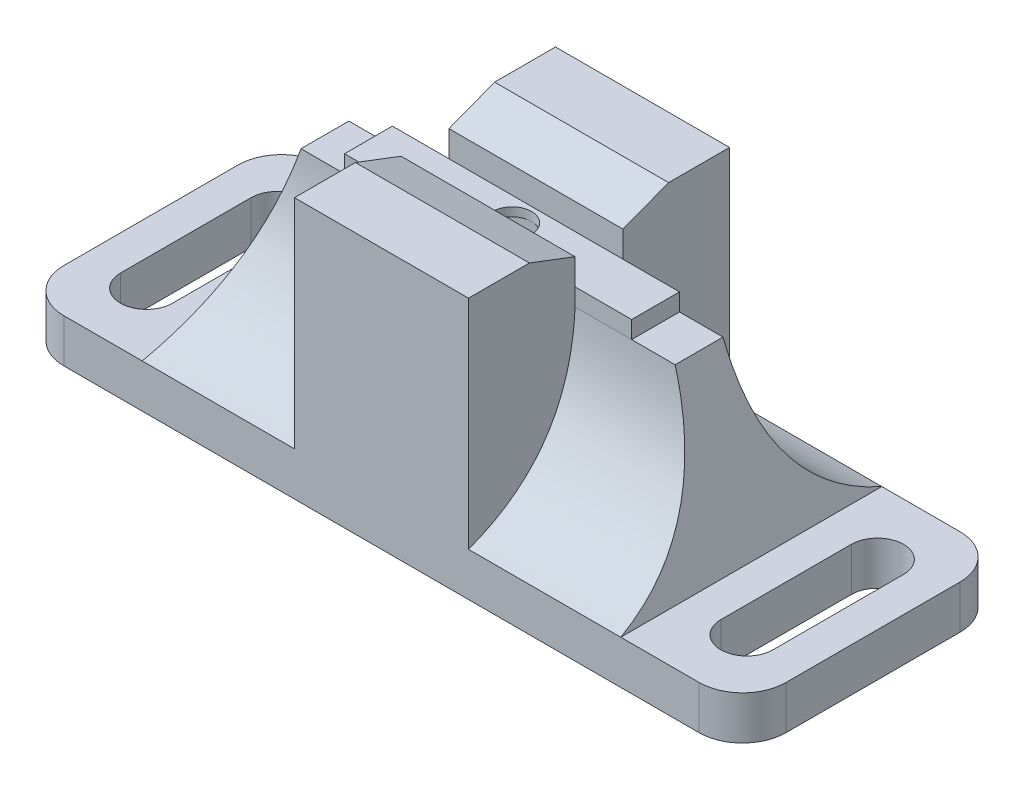
from build123d import *

# Parameters (mm, degrees)
BOSS_EXTRUDE1_DEPTH     = 5
BOSS_EXTRUDE2_DEPTH     = 27.5
BOSS_EXTRUDE3_DEPTH     = 10
CUT_EXTRUDE2_DEPTH      = 51.717354111
CUT_EXTRUDE2_DEPTH_BACK = 51.717354111
SKETCH5_3_W             = 6.5
SKETCH5_3_H             = 2
SKETCH5_3_W_2           = 20
BOSS_EXTRUDE4_DEPTH     = 2.75
CUT_EXTRUDE3_DEPTH      = 54.359629019
CUT_EXTRUDE3_DEPTH_BACK = 24
M4_CLEARANCE_HOLE1_D    = 4.5


with BuildPart() as part:
    # Sketch1 → Boss-Extrude1 (new body)
    with BuildSketch(Plane(origin=(0, 0, 0), x_dir=(1, 0, 0), z_dir=(0, 1, 0))):
        with BuildLine():
            Line((-36.5, 15), (36.5, 15))
            ThreePointArc((36.5, 15), (40.035533906, 13.535533906), (41.5, 10))
            Line((41.5, 10), (41.5, -10))
            ThreePointArc((41.5, -10), (40.035533906, -13.535533906), (36.5, -15))
            Line((36.5, -15), (-36.5, -15))
            ThreePointArc((-36.5, -15), (-40.035533906, -13.535533906), (-41.5, -10))
            Line((-41.5, -10), (-41.5, 10))
            ThreePointArc((-41.5, 10), (-40.035533906, 13.535533906), (-36.5, 15))
        make_face()
        with BuildLine():
            Line((-31.5, 7.5), (-31.5, -7.5))
            ThreePointArc((-31.5, -7.5), (-34.5, -10.5), (-37.5, -7.5))
            Line((-37.5, -7.5), (-37.5, 7.5))
            ThreePointArc((-37.5, 7.5), (-34.5, 10.5), (-31.5, 7.5))
        make_face(mode=Mode.SUBTRACT)
        with BuildLine():
            Line((31.5, 7.5), (31.5, -7.5))
            ThreePointArc((31.5, -7.5), (34.5, -10.5), (37.5, -7.5))
            Line((37.5, -7.5), (37.5, 7.5))
            ThreePointArc((37.5, 7.5), (34.5, 10.5), (31.5, 7.5))
        make_face(mode=Mode.SUBTRACT)
    extrude(amount=-BOSS_EXTRUDE1_DEPTH)

    # Sketch2 → Boss-Extrude2 (add, symmetric)
    with BuildSketch(Plane(origin=(0, 0, 0), x_dir=(0, 0, -1), z_dir=(1, 0, 0))):
        with BuildLine():
            Line((-15, 0), (0, 0))
            Line((0, 0), (0, 18))
            Line((0, 18), (-2.75, 18))
            add(Edge.make_bspline(
                [(-15, 0), (-3.342305564, 4.287493928), (-2.75, 18)],
                knots=[0, 0, 0, 1, 1, 1], degree=2))
        make_face()
        with BuildLine():
            Line((0, 18), (0, 0))
            Line((0, 0), (15, 0))
            add(Edge.make_bspline(
                [(15, 0), (3.342305564, 4.287493928), (2.75, 18)],
                knots=[0, 0, 0, 1, 1, 1], degree=2))
            Line((2.75, 18), (0, 18))
        make_face()
    extrude(amount=BOSS_EXTRUDE2_DEPTH, both=True)

    # Sketch2<3> → Boss-Extrude3 (add, symmetric)
    with BuildSketch(Plane(origin=(0, 0, 0), x_dir=(0, 0, -1), z_dir=(1, 0, 0))):
        with BuildLine():
            Line((-15, 0), (-15, 25))
            Line((-15, 25), (-8, 25))
            Line((-8, 25), (-2.75, 23))
            Line((-2.75, 23), (-2.75, 18))
            add(Edge.make_bspline(
                [(-15, 0), (-3.342305564, 4.287493928), (-2.75, 18)],
                knots=[0, 0, 0, 1, 1, 1], degree=2))
        make_face()
        with BuildLine():
            add(Edge.make_bspline(
                [(15, 0), (3.342305564, 4.287493928), (2.75, 18)],
                knots=[0, 0, 0, 1, 1, 1], degree=2))
            Line((2.75, 18), (2.75, 23))
            Line((2.75, 23), (8, 25))
            Line((8, 25), (15, 25))
            Line((15, 25), (15, 0))
        make_face()
    extrude(amount=BOSS_EXTRUDE3_DEPTH, both=True)

    # Sketch5 → Cut-Extrude2 (cut, two sides: drawn at the far end of the back side and taken through both)
    with BuildSketch(Plane.XY.offset(-CUT_EXTRUDE2_DEPTH_BACK)):
        Polygon((-27.5, 18), (-27.5, 0), (-21.5, 18), align=None)
        Polygon((21.5, 18), (27.5, 0), (27.5, 18), align=None)
    extrude(amount=CUT_EXTRUDE2_DEPTH + CUT_EXTRUDE2_DEPTH_BACK, mode=Mode.SUBTRACT)

    # Sketch5<3> → Boss-Extrude4 (add, symmetric)
    with BuildSketch(Plane.XY):
        with Locations((13.25, 19)):
            Rectangle(SKETCH5_3_W, SKETCH5_3_H)
        with Locations((-13.25, 19)):
            Rectangle(SKETCH5_3_W, SKETCH5_3_H)
        with Locations((0, 19)):
            Rectangle(SKETCH5_3_W_2, SKETCH5_3_H)
    extrude(amount=BOSS_EXTRUDE4_DEPTH, both=True)

    # Sketch6 → Cut-Extrude3 (cut, two sides: drawn at the far end of the back side and taken through both)
    with BuildSketch(Plane.XZ.offset(5).offset(-CUT_EXTRUDE3_DEPTH_BACK)):
        Polygon((16, 2.25), (10, 2.25), (-10, 2.25), (-16, 2.25), (-16, -2.25), (-10, -2.25), (10, -2.25), (16, -2.25), align=None)
    extrude(amount=CUT_EXTRUDE3_DEPTH + CUT_EXTRUDE3_DEPTH_BACK, mode=Mode.SUBTRACT)

    # M4 Clearance Hole1 (through all)
    with Locations(Plane(origin=(0, 20, 0), x_dir=(1, 0, 0), z_dir=(0, 1, 0))):
        with Locations((0, 0)):
            Hole(M4_CLEARANCE_HOLE1_D / 2)


solid = part.part
